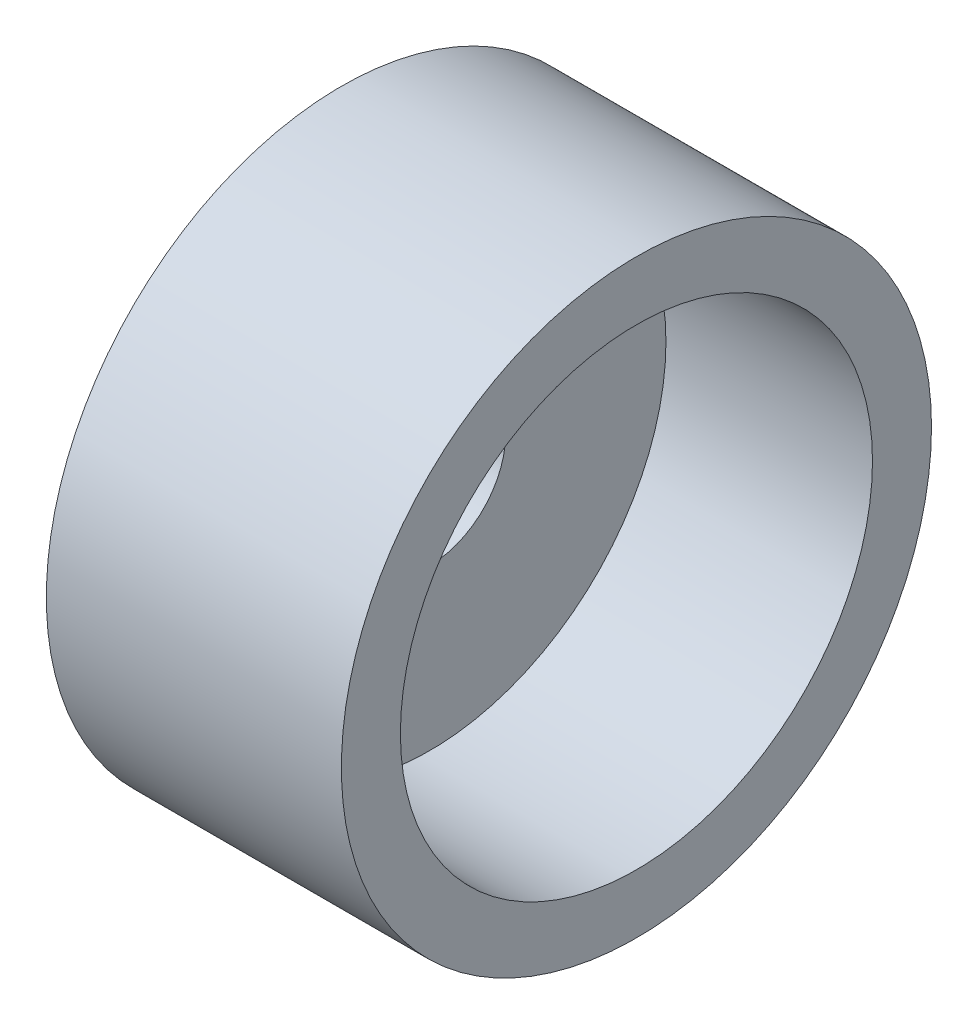
from build123d import *

# Parameters (mm, degrees)
ESBO_O1_R                = 50
RESSALTO_EXTRUS_O1_DEPTH = 50
ESBO_O2_R                = 40
CORTE_EXTRUS_O1_DEPTH    = 35
CORTE_EXTRUS_O2_DEPTH    = 10
ESBO_O4_R                = 12.832707742
CORTE_EXTRUS_O3_DEPTH    = 82.240384046


with BuildPart() as part:
    # Esboço1 → Ressalto-extrusão1 (new body)
    with BuildSketch(Plane(origin=(0, 0, 0), x_dir=(0, 0, -1), z_dir=(1, 0, 0))):
        Circle(ESBO_O1_R)
    extrude(amount=RESSALTO_EXTRUS_O1_DEPTH)

    # Esboço2 → Corte-extrusão1 (cut)
    with BuildSketch(Plane(origin=(50, 0, 0), x_dir=(0, 0, -1), z_dir=(1, 0, 0))):
        Circle(ESBO_O2_R)
    extrude(amount=-CORTE_EXTRUS_O1_DEPTH, mode=Mode.SUBTRACT)

    # Esboço3 → Corte-extrusão2 (cut)
    with BuildSketch(Plane.ZY):
        Polygon((-11.812450534, 20.459764487), (11.812450534, 20.459764487), (23.624901068, 0), (11.812450534, -20.459764487), (-11.812450534, -20.459764487), (-23.624901068, 0), align=None)
    extrude(amount=-CORTE_EXTRUS_O2_DEPTH, mode=Mode.SUBTRACT)

    # Esboço4 → Corte-extrusão3 (cut, through all)
    with BuildSketch(Plane.ZY.offset(-10)):
        Circle(ESBO_O4_R)
    extrude(amount=-CORTE_EXTRUS_O3_DEPTH, mode=Mode.SUBTRACT)


solid = part.part
